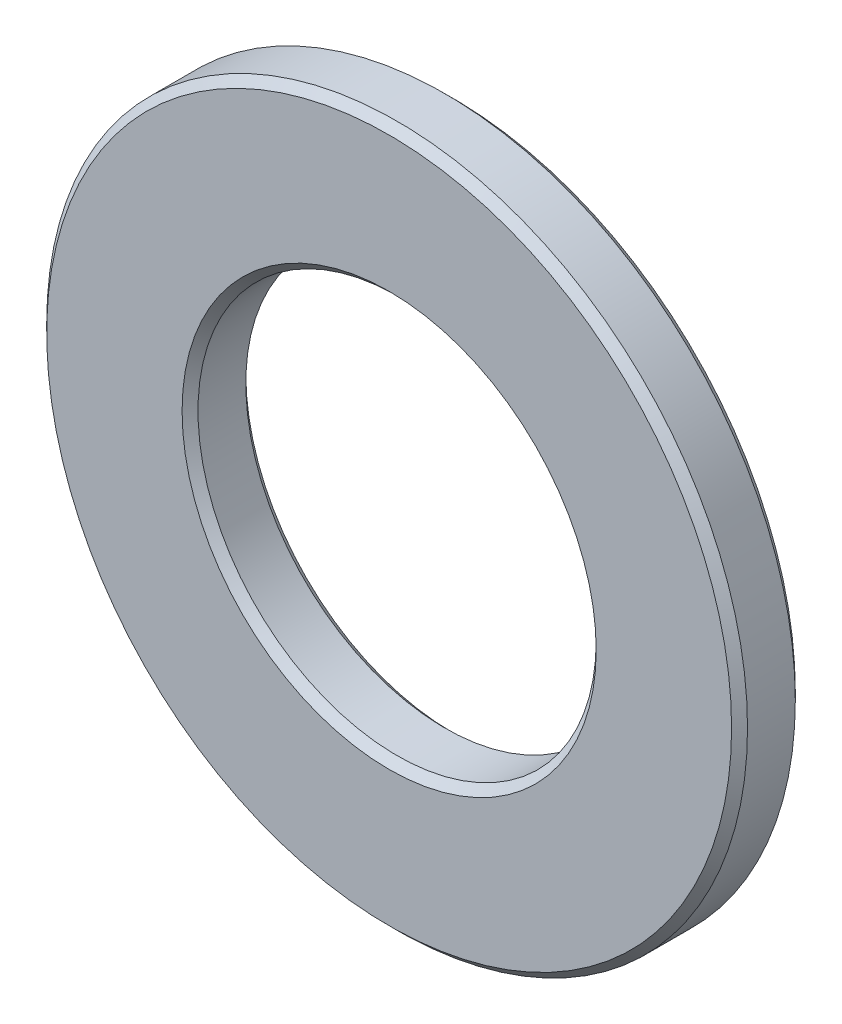
from build123d import *

# Parameters (mm, degrees)
SZKIC1_R                    = 22
SZKIC1_R_2                  = 12.5
DODANIE_WYCI_GNI_CIE1_DEPTH = 4
SFAZOWANIE1_SIZE            = 0.5


with BuildPart() as part:
    # Szkic1 → Dodanie-wyciągnięcie1 (new body)
    with BuildSketch(Plane.XY):
        Circle(SZKIC1_R)
        Circle(SZKIC1_R_2, mode=Mode.SUBTRACT)
    extrude(amount=DODANIE_WYCI_GNI_CIE1_DEPTH)

    # Sfazowanie1
    sfazowanie1_edges = [part.edges().sort_by_distance(p)[0] for p in [
        (-22, 0, 0),
        (-22, 0, 4),
        (-12.5, 0, 0),
        (-12.5, 0, 4),
    ]]
    chamfer(sfazowanie1_edges, length=SFAZOWANIE1_SIZE)


solid = part.part
